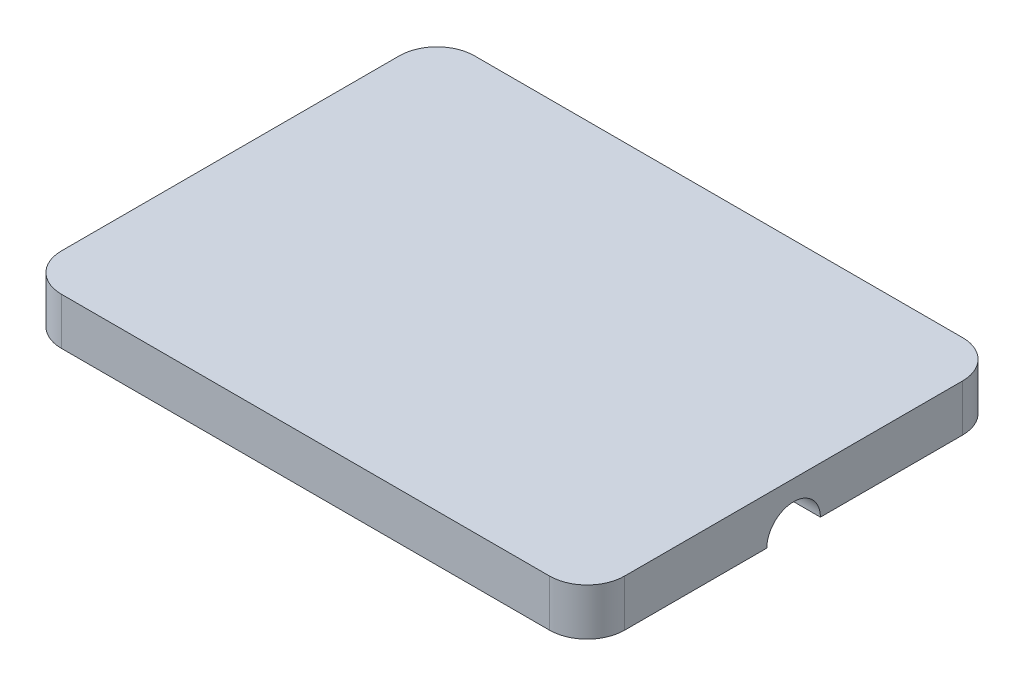
from build123d import *

# Parameters (mm, degrees)
BOSS_EXTRUDE1_DEPTH = 25
SKETCH2_R           = 14.285
CUT_EXTRUDE1_DEPTH  = 321.507410211


with BuildPart() as part:
    # Sketch1 → Boss-Extrude1 (new body)
    with BuildSketch(Plane(origin=(0, 0, 0), x_dir=(1, 0, 0), z_dir=(0, 1, 0))):
        with BuildLine():
            Line((0, 0), (0, 90))
            ThreePointArc((0, 90), (5.857864376, 104.142135624), (20, 110))
            Line((20, 110), (280, 110))
            ThreePointArc((280, 110), (294.142135624, 104.142135624), (300, 90))
            Line((300, 90), (300, 0))
            Line((300, 0), (300, -90))
            ThreePointArc((300, -90), (294.142135624, -104.142135624), (280, -110))
            Line((280, -110), (20, -110))
            ThreePointArc((20, -110), (5.857864376, -104.142135624), (0, -90))
            Line((0, -90), (0, 0))
        make_face()
    extrude(amount=BOSS_EXTRUDE1_DEPTH)

    # Sketch2 → Cut-Extrude1 (cut, through all)
    with BuildSketch(Plane(origin=(0, 0, 0), x_dir=(0, 0, -1), z_dir=(1, 0, 0))):
        Circle(SKETCH2_R)
    extrude(amount=CUT_EXTRUDE1_DEPTH, mode=Mode.SUBTRACT)


solid = part.part
